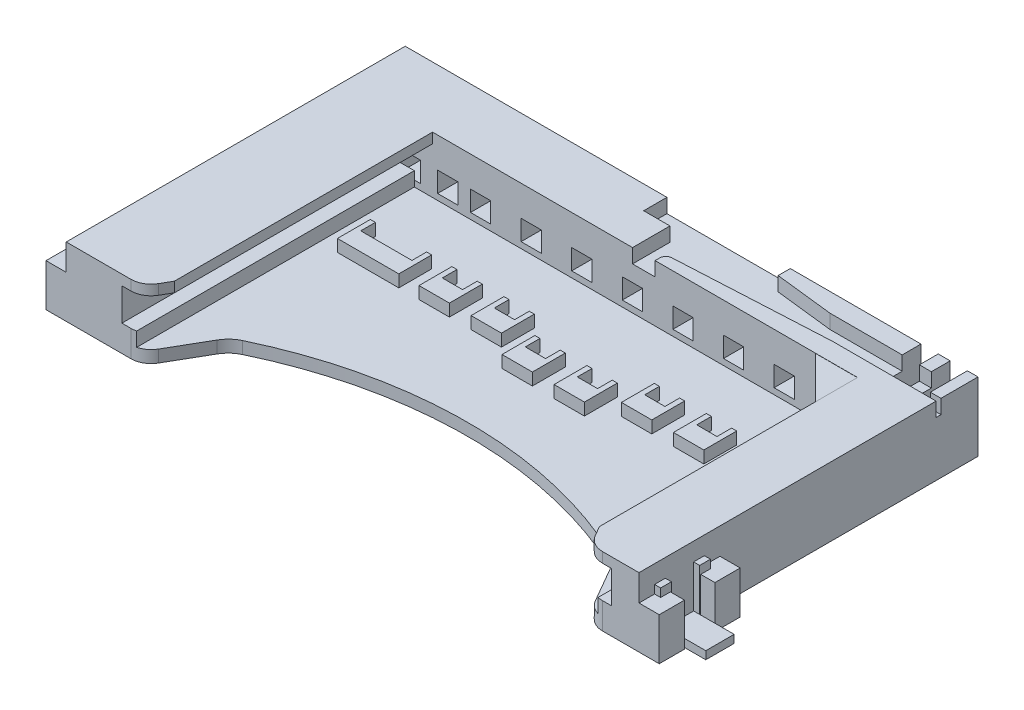
from build123d import *

# Parameters (mm, degrees)
RESSALTO_EXTRUS_O1_DEPTH    = 3.4
CORTE_EXTRUS_O1_DEPTH       = 13.75
CORTE_EXTRUS_O2_DEPTH       = 1
ESBO_O4_W                   = 1.25
ESBO_O4_H                   = 2.1
RESSALTO_EXTRUS_O2_DEPTH    = 1
ESBO_O5_W                   = 0.53
ESBO_O5_H                   = 2.51
RESSALTO_EXTRUS_O3_DEPTH    = 0.3
ESBO_O6_W                   = 1.4
ESBO_O6_H                   = 0.39
RESSALTO_EXTRUS_O4_DEPTH    = 2
ESBO_O7_R                   = 0.75
RESSALTO_EXTRUS_O5_DEPTH    = 0.8
FILETE1_R                   = 0.3
RESSALTO_EXTRUS_O6_DEPTH    = 0.6
RESSALTO_EXTRUS_O7_DEPTH    = 0.6
PADR_O_LINEAR1_COUNT        = 2
PADR_O_LINEAR1_PITCH        = 2.571
PADR_O_LINEAR2_COUNT        = 2
PADR_O_LINEAR2_PITCH        = 10
PADR_O_LINEAR2_COPY_1_DEPTH = 0.6
PADR_O_LINEAR3_COUNT        = 2
PADR_O_LINEAR3_PITCH        = 5
PADR_O_LINEAR3_COUNT_DIR2   = 2
PADR_O_LINEAR3_PITCH_DIR2   = 0.9
PADR_O_LINEAR3_COPY_1_DEPTH = 0.6
PADR_O_LINEAR4_COUNT        = 2
PADR_O_LINEAR4_PITCH        = 15
PADR_O_LINEAR4_COUNT_DIR2   = 2
PADR_O_LINEAR4_PITCH_DIR2   = 2.8
ESBO_O10_W                  = 2.08
ESBO_O10_H                  = 2.08
CORTE_EXTRUS_O3_DEPTH       = 0.01
CORTE_EXTRUS_O4_DEPTH       = 0.7
ESBO_O12_W                  = 0.85
ESBO_O12_H                  = 3.010299587
ESBO_O12_H_2                = 3.148237164
CORTE_EXTRUS_O5_DEPTH       = 2.5
ESBO_O14_W                  = 1
ESBO_O14_H                  = 1
CORTE_EXTRUS_O6_DEPTH       = 3
PADR_O_LINEAR5_COUNT        = 8
PADR_O_LINEAR5_PITCH        = 2.5
PADR_O_LINEAR6_COUNT        = 2
PADR_O_LINEAR6_PITCH        = 1.625
PADR_O_LINEAR7_COUNT        = 2
PADR_O_LINEAR7_PITCH        = 3.47
PADR_O_LINEAR8_COUNT        = 2
PADR_O_LINEAR8_PITCH        = 5.12
ESBO_O15_W                  = 0.5254
ESBO_O15_H                  = 0.24
CORTE_EXTRUS_O7_DEPTH       = 0.7


with BuildPart() as part:
    # Esboço1 → Ressalto-extrusão1 (new body)
    with BuildSketch(Plane(origin=(0, 0, 0), x_dir=(1, 0, 0), z_dir=(0, 1, 0))):
        with BuildLine():
            Line((-10.7865, 26.278571699), (-9.7275, 28.112571699))
            ThreePointArc((-9.7275, 28.112571699), (-9.447610346, 28.46331272), (-9.0765, 28.715571699))
            ThreePointArc((-9.0765, 28.715571699), (0, 30.778382157), (9.0765, 28.715571699))
            ThreePointArc((9.0765, 28.715571699), (9.447610346, 28.46331272), (9.7275, 28.112571699))
            Line((9.7275, 28.112571699), (10.7865, 26.278571699))
            ThreePointArc((10.7865, 26.278571699), (11.152514404, 25.912552647), (11.6525, 25.778571699))
            Line((11.6525, 25.778571699), (13.45, 25.778571699))
            Line((13.45, 25.778571699), (13.45, 42.528571699))
            Line((13.45, 42.528571699), (-14.85, 42.528571699))
            Line((-14.85, 42.528571699), (-14.85, 25.778571699))
            Line((-14.85, 25.778571699), (-11.6525, 25.778571699))
            ThreePointArc((-11.6525, 25.778571699), (-11.152514404, 25.912552647), (-10.7865, 26.278571699))
        make_face()
    extrude(amount=RESSALTO_EXTRUS_O1_DEPTH)

    # Esboço2 → Corte-extrusão1 (cut)
    with BuildSketch(Plane.XY.offset(-25.778571699)):
        Polygon((-11.4, 0.6), (11.4, 0.6), (11.4, 1.3), (12.1, 1.3), (12.1, 2.9), (-12.1, 2.9), (-12.1, 1.3), (-11.4, 1.3), align=None)
    extrude(amount=-CORTE_EXTRUS_O1_DEPTH, mode=Mode.SUBTRACT)

    # Esboço3 → Corte-extrusão2 (cut)
    with BuildSketch(Plane(origin=(0, 3.4, 0), x_dir=(1, 0, 0), z_dir=(0, 1, 0))):
        Polygon((-10.5, 25.778571699), (10.5, 25.778571699), (10.5, 37.448571699), (8.42, 39.528571699), (-10.5, 39.528571699), align=None)
    extrude(amount=-CORTE_EXTRUS_O2_DEPTH, mode=Mode.SUBTRACT)

    # Esboço4 → Ressalto-extrusão2 (add)
    with BuildSketch(Plane(origin=(13.45, 0, 0), x_dir=(0, 0, -1), z_dir=(1, 0, 0))):
        with Locations((26.403571699, 1.05)):
            Rectangle(ESBO_O4_W, ESBO_O4_H)
        with Locations((29.153571699, 1.05)):
            Rectangle(ESBO_O4_W, ESBO_O4_H)
    ressalto_extrus_o2 = extrude(amount=RESSALTO_EXTRUS_O2_DEPTH)

    # Esboço5 → Ressalto-extrusão3 (add)
    with BuildSketch(Plane(origin=(13.45, 0, 0), x_dir=(0, 0, -1), z_dir=(1, 0, 0))):
        with Locations((26.813571699, 1.255)):
            Rectangle(ESBO_O5_W, ESBO_O5_H)
        with Locations((28.743571699, 1.255)):
            Rectangle(ESBO_O5_W, ESBO_O5_H)
    ressalto_extrus_o3 = extrude(amount=RESSALTO_EXTRUS_O3_DEPTH)

    # Esboço6 → Ressalto-extrusão4 (add)
    with BuildSketch(Plane(origin=(13.45, 0, 0), x_dir=(0, 0, -1), z_dir=(1, 0, 0))):
        with Locations((27.778571699, 0.215)):
            Rectangle(ESBO_O6_W, ESBO_O6_H)
    ressalto_extrus_o4 = extrude(amount=RESSALTO_EXTRUS_O4_DEPTH)

    # Espelhar1: Ressalto-extrusão2 across plane
    add(ressalto_extrus_o2.mirror(Plane.ZY.offset(0.7)))

    # Espelhar2: Ressalto-extrusão3, Ressalto-extrusão4 across plane
    add(ressalto_extrus_o3.mirror(Plane.ZY.offset(0.7)))
    add(ressalto_extrus_o4.mirror(Plane.ZY.offset(0.7)))

    # Esboço7 → Ressalto-extrusão5 (add)
    with BuildSketch(Plane(origin=(0, 0, 0), x_dir=(-1, 0, 0), z_dir=(0, -1, 0))):
        with Locations(Location((-11.95, 41.028571699, 0), (0, 0, 90))):
            Circle(ESBO_O7_R)
        with Locations(Location((13.35, 41.028571699, 0), (0, 0, 90))):
            Circle(ESBO_O7_R)
    extrude(amount=RESSALTO_EXTRUS_O5_DEPTH)

    # Filete1
    filete1_edges = [part.edges().sort_by_distance(p)[0] for p in [
        (11.95, -0.8, -40.278571699),
        (-13.35, -0.8, -40.278571699),
    ]]
    fillet(filete1_edges, radius=FILETE1_R)

    # Esboço8 → Ressalto-extrusão6 (add)
    with BuildSketch(Plane(origin=(0, 0.6, 0), x_dir=(1, 0, 0), z_dir=(0, 1, 0))):
        Polygon((-10.5, 36.453571699), (-10.25, 36.453571699), (-10.25, 35.728571699), (-7.718552213, 35.728571699), (-7.718552213, 36.453571699), (-7.468552213, 36.453571699), (-7.468552213, 34.828571699), (-10.5, 34.828571699), align=None)
    extrude(amount=RESSALTO_EXTRUS_O6_DEPTH)

    # Esboço9 → Ressalto-extrusão7 (add)
    with BuildSketch(Plane(origin=(0, 0.6, 0), x_dir=(1, 0, 0), z_dir=(0, 1, 0))):
        Polygon((-6.468552213, 34.828571699), (-4.968552213, 34.828571699), (-4.968552213, 36.453571699), (-5.218552213, 36.453571699), (-5.218552213, 35.728571699), (-6.218552213, 35.728571699), (-6.218552213, 36.453571699), (-6.468552213, 36.453571699), align=None)
    ressalto_extrus_o7 = extrude(amount=RESSALTO_EXTRUS_O7_DEPTH)

    # Padrão linear1: Ressalto-extrusão7 ×2
    with Locations(*[(i * PADR_O_LINEAR1_PITCH, 0, 0) for i in range(1, PADR_O_LINEAR1_COUNT)]):
        add(ressalto_extrus_o7)

    # Padrão linear2: Ressalto-extrusão7 ×2
    with Locations(*[(i * PADR_O_LINEAR2_PITCH, 0, 0) for i in range(1, PADR_O_LINEAR2_COUNT)]):
        add(ressalto_extrus_o7)

    # Padrão linear2 copy 1 sketch → Padrão linear2 copy 1 (add)
    with BuildSketch(Plane(origin=(12.571, 0.6, 0), x_dir=(1, 0, 0), z_dir=(0, 1, 0))):
        Polygon((-6.468552213, 34.828571699), (-4.968552213, 34.828571699), (-4.968552213, 36.453571699), (-5.218552213, 36.453571699), (-5.218552213, 35.728571699), (-6.218552213, 35.728571699), (-6.218552213, 36.453571699), (-6.468552213, 36.453571699), align=None)
    extrude(amount=PADR_O_LINEAR2_COPY_1_DEPTH)

    # Padrão linear3: Ressalto-extrus_o7 2 × 2, 2 skipped
    with Locations(*[(i * PADR_O_LINEAR3_PITCH, 0, j * PADR_O_LINEAR3_PITCH_DIR2) for i in range(PADR_O_LINEAR3_COUNT) for j in range(PADR_O_LINEAR3_COUNT_DIR2) if (i, j) not in ((0, 0), (0, 1), (1, 0))]):
        add(ressalto_extrus_o7)

    # Padrão linear3 copy 1 sketch → Padrão linear3 copy 1 (add)
    with BuildSketch(Plane(origin=(7.571, 0.6, 0.9), x_dir=(1, 0, 0), z_dir=(0, 1, 0))):
        Polygon((-6.468552213, 34.828571699), (-4.968552213, 34.828571699), (-4.968552213, 36.453571699), (-5.218552213, 36.453571699), (-5.218552213, 35.728571699), (-6.218552213, 35.728571699), (-6.218552213, 36.453571699), (-6.468552213, 36.453571699), align=None)
    extrude(amount=PADR_O_LINEAR3_COPY_1_DEPTH)

    # Padrão linear4: Ressalto-extrus_o7 2 × 2, 2 skipped
    with Locations(*[(i * PADR_O_LINEAR4_PITCH, 0, j * PADR_O_LINEAR4_PITCH_DIR2) for i in range(PADR_O_LINEAR4_COUNT) for j in range(PADR_O_LINEAR4_COUNT_DIR2) if (i, j) not in ((0, 0), (0, 1), (1, 0))]):
        add(ressalto_extrus_o7)

    # Esboço10 → Corte-extrusão3 (cut)
    with BuildSketch(Plane(origin=(0, 3.4, 0), x_dir=(1, 0, 0), z_dir=(0, 1, 0))):
        with Locations((9.46, 38.488571699)):
            Rectangle(ESBO_O10_W, ESBO_O10_H)
    extrude(amount=-CORTE_EXTRUS_O3_DEPTH, mode=Mode.SUBTRACT)

    # Esboço11 → Corte-extrusão4 (cut)
    with BuildSketch(Plane(origin=(0, 3.4, 0), x_dir=(1, 0, 0), z_dir=(0, 1, 0))):
        with BuildLine():
            Line((-1.92, 42.528571699), (-1.92, 41.378571699))
            Line((-1.92, 41.378571699), (-0.62, 41.378571699))
            Line((-0.62, 41.378571699), (-0.62, 38.891203839))
            Line((-0.62, 38.891203839), (0.495, 38.891203839))
            Line((0.495, 38.891203839), (0.495, 39.762171699))
            ThreePointArc((0.495, 39.762171699), (0.577387407, 39.968677775), (0.779298396, 40.061760517))
            Line((0.779298396, 40.061760517), (8.350298396, 40.458560517))
            Line((8.350298396, 40.458560517), (12.9246, 40.458560517))
            Line((12.9246, 40.458560517), (12.9246, 41.598571699))
            Line((12.9246, 41.598571699), (7.071, 41.598571699))
            Line((7.071, 41.598571699), (4.175, 41.928571699))
            Line((4.175, 41.928571699), (4.175, 43.072994051))
            Line((4.175, 43.072994051), (-1.92, 42.528571699))
        make_face()
    extrude(amount=-CORTE_EXTRUS_O4_DEPTH, mode=Mode.SUBTRACT)

    # Esboço12 → Corte-extrusão5 (cut)
    with BuildSketch(Plane(origin=(0, 3.4, 0), x_dir=(1, 0, 0), z_dir=(0, 1, 0))):
        with Locations((12.4996, 41.963710311)):
            Rectangle(ESBO_O12_W, ESBO_O12_H)
        with Locations((11.0596, 42.032679099)):
            Rectangle(ESBO_O12_W, ESBO_O12_H_2)
    extrude(amount=-CORTE_EXTRUS_O5_DEPTH, mode=Mode.SUBTRACT)

    # Esboço14 → Corte-extrusão6 (cut)
    with BuildSketch(Plane(origin=(0, 0, -42.528571699), x_dir=(-1, 0, 0), z_dir=(0, 0, -1))):
        with Locations((8.125, 1.4)):
            Rectangle(ESBO_O14_W, ESBO_O14_H)
    corte_extrus_o6 = extrude(amount=-CORTE_EXTRUS_O6_DEPTH, mode=Mode.SUBTRACT)

    # Padrão linear5: Corte-extrusão6 ×8
    with Locations(*[(i * PADR_O_LINEAR5_PITCH, 0, 0) for i in range(1, PADR_O_LINEAR5_COUNT)]):
        add(corte_extrus_o6, mode=Mode.SUBTRACT)

    # Padrão linear6: Corte-extrusão6 ×2
    with Locations(*[(-i * PADR_O_LINEAR6_PITCH, 0, 0) for i in range(1, PADR_O_LINEAR6_COUNT)]):
        add(corte_extrus_o6, mode=Mode.SUBTRACT)

    # Padrão linear7: Corte-extrusão6 ×2
    with Locations(*[(-i * PADR_O_LINEAR7_PITCH, 0, 0) for i in range(1, PADR_O_LINEAR7_COUNT)]):
        add(corte_extrus_o6, mode=Mode.SUBTRACT)

    # Padrão linear8: Corte-extrusão6 ×2
    with Locations(*[(-i * PADR_O_LINEAR8_PITCH, 0, 0) for i in range(1, PADR_O_LINEAR8_COUNT)]):
        add(corte_extrus_o6, mode=Mode.SUBTRACT)

    # Esboço15 → Corte-extrusão7 (cut)
    with BuildSketch(Plane(origin=(0, 3.4, 0), x_dir=(1, 0, 0), z_dir=(0, 1, 0))):
        with Locations((13.1873, 40.578560517)):
            Rectangle(ESBO_O15_W, ESBO_O15_H)
    extrude(amount=-CORTE_EXTRUS_O7_DEPTH, mode=Mode.SUBTRACT)


solid = part.part
